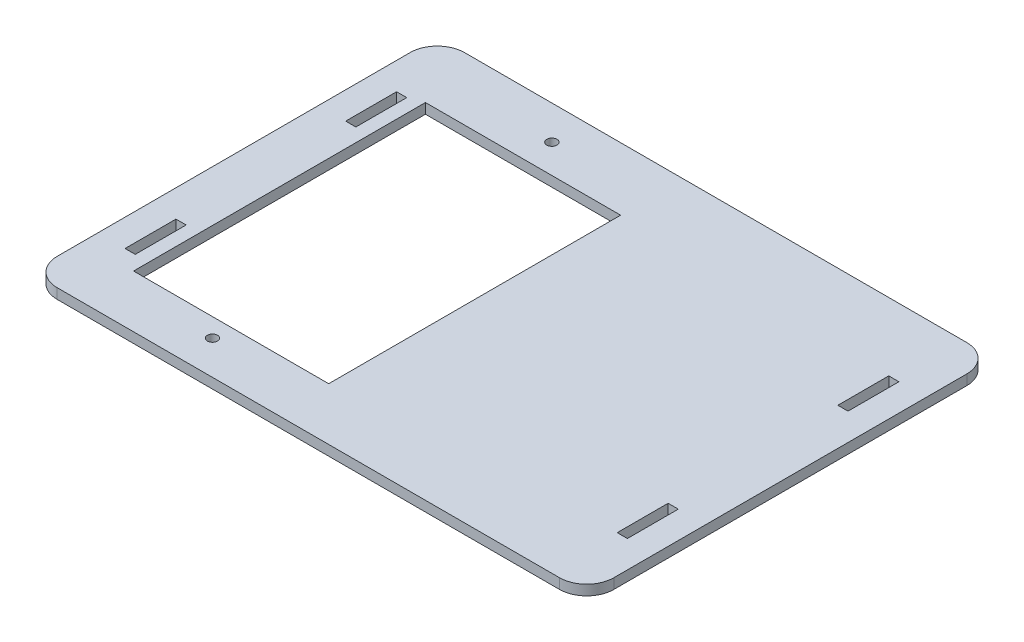
from build123d import *

# Parameters (mm, degrees)
BOSS_EXTRUDE1_DEPTH = 3
SKETCH2_R           = 1.5
SKETCH2_W           = 57.5
SKETCH2_H           = 86
CUT_EXTRUDE1_DEPTH  = 102.651364969
SKETCH3_W           = 3
SKETCH3_H           = 15
CUT_EXTRUDE2_DEPTH  = 102.651364969


with BuildPart() as part:
    # Sketch1 → Boss-Extrude1 (new body)
    with BuildSketch(Plane(origin=(0, 0, 0), x_dir=(1, 0, 0), z_dir=(0, 1, 0))):
        with BuildLine():
            Line((-74, 60), (74, 60))
            ThreePointArc((74, 60), (79.656854249, 57.656854249), (82, 52))
            Line((82, 52), (82, -52))
            ThreePointArc((82, -52), (79.656854249, -57.656854249), (74, -60))
            Line((74, -60), (-74, -60))
            ThreePointArc((-74, -60), (-79.656854249, -57.656854249), (-82, -52))
            Line((-82, -52), (-82, 52))
            ThreePointArc((-82, 52), (-79.656854249, 57.656854249), (-74, 60))
        make_face()
    extrude(amount=BOSS_EXTRUDE1_DEPTH)

    # Sketch2 → Cut-Extrude1 (cut, through all)
    with BuildSketch(Plane(origin=(0, 3, 0), x_dir=(1, 0, 0), z_dir=(0, 1, 0))):
        with Locations(Location((-38.25, 50, 0), (0, 0, 270))):
            Circle(SKETCH2_R)
        with Locations(Location((-38.25, -50, 0), (0, 0, 270))):
            Circle(SKETCH2_R)
        with Locations((-38.25, -1.5)):
            Rectangle(SKETCH2_W, SKETCH2_H)
    extrude(amount=-CUT_EXTRUDE1_DEPTH, mode=Mode.SUBTRACT)

    # Sketch3 → Cut-Extrude2 (cut, through all)
    with BuildSketch(Plane(origin=(0, 3, 0), x_dir=(1, 0, 0), z_dir=(0, 1, 0))):
        with Locations((-72.5, 32.5)):
            Rectangle(SKETCH3_W, SKETCH3_H)
        with Locations((-72.5, -32.5)):
            Rectangle(SKETCH3_W, SKETCH3_H)
        with Locations((72.5, -32.5)):
            Rectangle(SKETCH3_W, SKETCH3_H)
        with Locations((72.5, 32.5)):
            Rectangle(SKETCH3_W, SKETCH3_H)
    extrude(amount=-CUT_EXTRUDE2_DEPTH, mode=Mode.SUBTRACT)


solid = part.part
